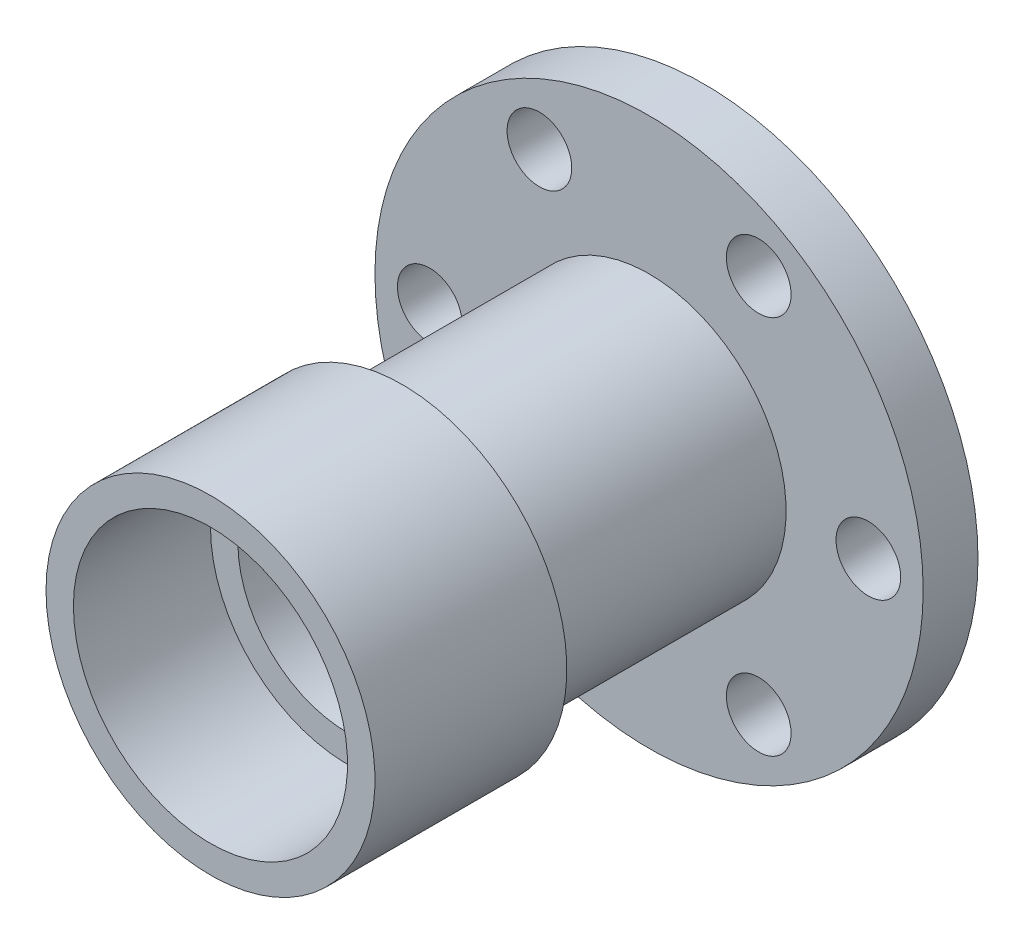
from build123d import *

# Parameters (mm, degrees)
SKETCH2_R          = 5.9
CUT_EXTRUDE1_DEPTH = 10


with BuildPart() as part:
    # Sketch1 → Revolve1 (revolve)
    with BuildSketch(Plane(origin=(0, 0, 0), x_dir=(0, 0, -1), z_dir=(1, 0, 0)), mode=Mode.PRIVATE) as revolve1_sk:
        Polygon((0, 20), (0, 50), (-10, 50), (-10, 25), (-55, 25), (-55, 30), (-90, 30), (-90, 25), (-65, 25), (-65, 20), align=None)
    revolve(revolve1_sk.sketch.rotate(Axis((0, 0, 0), (0, 0, 1)), 90), axis=Axis((0, 0, 0), (0, 0, 1)))

    # Sketch2 → Cut-Extrude1 (cut)
    with BuildSketch(Plane.XY.offset(10)):
        with Locations((40, 0)):
            Circle(SKETCH2_R)
        with Locations((20, -34.641016151)):
            Circle(SKETCH2_R)
        with Locations((-20, -34.641016151)):
            Circle(SKETCH2_R)
        with Locations((-40, 0)):
            Circle(SKETCH2_R)
        with Locations((-20, 34.641016151)):
            Circle(SKETCH2_R)
        with Locations((20, 34.641016151)):
            Circle(SKETCH2_R)
    extrude(amount=-CUT_EXTRUDE1_DEPTH, mode=Mode.SUBTRACT)


solid = part.part
